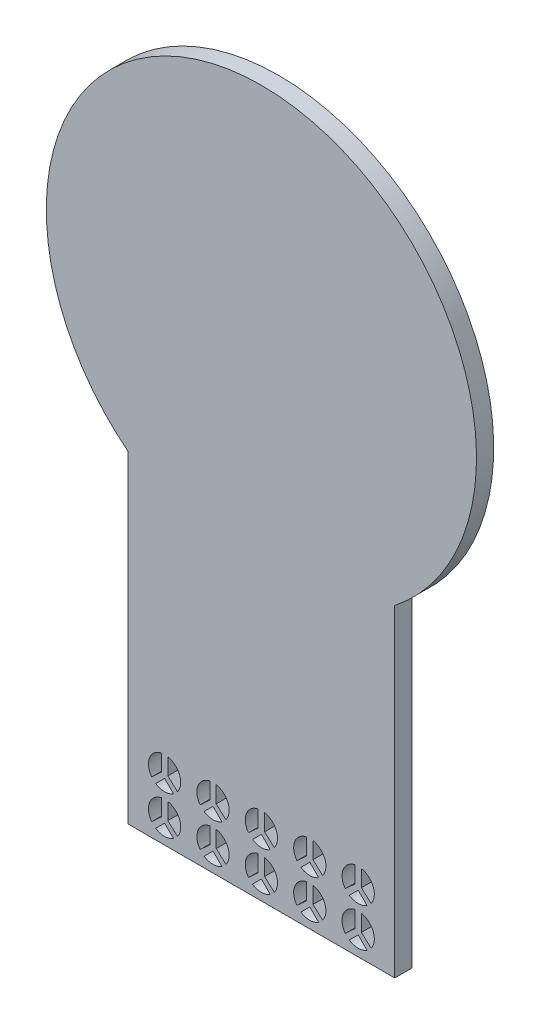
from build123d import *

# Parameters (mm, degrees)
EXTRUDE_1_DEPTH     = 8
CUT_EXTRUDE_1_DEPTH = 10


with BuildPart() as part:
    # 草图1 → 凸台-拉伸1 (new body)
    with BuildSketch(Plane.XY):
        with BuildLine():
            Line((0, 0), (124, 0))
            Line((124, 0), (124, 150))
            ThreePointArc((124, 150), (62, 328.460180984), (0, 150))
            Line((0, 150), (0, 0))
        make_face()
    extrude(amount=EXTRUDE_1_DEPTH)

    # 草图2 → 切除-拉伸1 (cut)
    with BuildSketch(Plane.XY.offset(8)):
        with BuildLine():
            Line((38.000879916, 18.335012989), (38.000879916, 10.614550667))
            Line((38.000879916, 10.614550667), (33.500377126, 6.485861413))
            ThreePointArc((33.500377126, 6.485861413), (32.48869593, 13.649372886), (38.000879916, 18.335012989))
        make_face()
        with BuildLine():
            Line((40.999120084, 18.335012989), (40.999120084, 10.614550667))
            Line((40.999120084, 10.614550667), (45.499622874, 6.485861413))
            ThreePointArc((45.499622874, 6.485861413), (46.51130407, 13.649372886), (40.999120084, 18.335012989))
        make_face()
        with BuildLine():
            Line((43.629589922, 4.725654413), (39.494098953, 8.861145382))
            Line((39.494098953, 8.861145382), (35.363302178, 4.730348608))
            ThreePointArc((35.363302178, 4.730348608), (39.495740959, 3.486365412), (43.629589922, 4.725654413))
        make_face()
        with BuildLine():
            Line((60.500879916, 18.335012989), (60.500879916, 10.614550667))
            Line((60.500879916, 10.614550667), (56.000377126, 6.485861413))
            ThreePointArc((56.000377126, 6.485861413), (54.98869593, 13.649372886), (60.500879916, 18.335012989))
        make_face()
        with BuildLine():
            Line((63.499120084, 18.335012989), (63.499120084, 10.614550667))
            Line((63.499120084, 10.614550667), (67.999622874, 6.485861413))
            ThreePointArc((67.999622874, 6.485861413), (69.01130407, 13.649372886), (63.499120084, 18.335012989))
        make_face()
        with BuildLine():
            Line((66.129589922, 4.725654413), (61.994098953, 8.861145382))
            Line((61.994098953, 8.861145382), (57.863302178, 4.730348608))
            ThreePointArc((57.863302178, 4.730348608), (61.995740959, 3.486365412), (66.129589922, 4.725654413))
        make_face()
        with BuildLine():
            Line((83.000879916, 18.335012989), (83.000879916, 10.614550667))
            Line((83.000879916, 10.614550667), (78.500377126, 6.485861413))
            ThreePointArc((78.500377126, 6.485861413), (77.48869593, 13.649372886), (83.000879916, 18.335012989))
        make_face()
        with BuildLine():
            Line((85.999120084, 18.335012989), (85.999120084, 10.614550667))
            Line((85.999120084, 10.614550667), (90.499622874, 6.485861413))
            ThreePointArc((90.499622874, 6.485861413), (91.51130407, 13.649372886), (85.999120084, 18.335012989))
        make_face()
        with BuildLine():
            Line((88.629589922, 4.725654413), (84.494098953, 8.861145382))
            Line((84.494098953, 8.861145382), (80.363302178, 4.730348608))
            ThreePointArc((80.363302178, 4.730348608), (84.495740959, 3.486365412), (88.629589922, 4.725654413))
        make_face()
        with BuildLine():
            Line((105.500879916, 18.335012989), (105.500879916, 10.614550667))
            Line((105.500879916, 10.614550667), (101.000377126, 6.485861413))
            ThreePointArc((101.000377126, 6.485861413), (99.98869593, 13.649372886), (105.500879916, 18.335012989))
        make_face()
        with BuildLine():
            Line((108.499120084, 18.335012989), (108.499120084, 10.614550667))
            Line((108.499120084, 10.614550667), (112.999622874, 6.485861413))
            ThreePointArc((112.999622874, 6.485861413), (114.01130407, 13.649372886), (108.499120084, 18.335012989))
        make_face()
        with BuildLine():
            Line((111.129589922, 4.725654413), (106.994098953, 8.861145382))
            Line((106.994098953, 8.861145382), (102.863302178, 4.730348608))
            ThreePointArc((102.863302178, 4.730348608), (106.995740959, 3.486365412), (111.129589922, 4.725654413))
        make_face()
        with BuildLine():
            Line((38.000879916, 36.335012989), (38.000879916, 28.614550667))
            Line((38.000879916, 28.614550667), (33.500377126, 24.485861413))
            ThreePointArc((33.500377126, 24.485861413), (32.48869593, 31.649372886), (38.000879916, 36.335012989))
        make_face()
        with BuildLine():
            Line((40.999120084, 36.335012989), (40.999120084, 28.614550667))
            Line((40.999120084, 28.614550667), (45.499622874, 24.485861413))
            ThreePointArc((45.499622874, 24.485861413), (46.51130407, 31.649372886), (40.999120084, 36.335012989))
        make_face()
        with BuildLine():
            Line((15.500879916, 18.335012989), (15.500879916, 10.614550667))
            Line((15.500879916, 10.614550667), (11.000377126, 6.485861413))
            ThreePointArc((11.000377126, 6.485861413), (9.98869593, 13.649372886), (15.500879916, 18.335012989))
        make_face()
        with BuildLine():
            Line((18.499120084, 18.335012989), (18.499120084, 10.614550667))
            Line((18.499120084, 10.614550667), (22.999622874, 6.485861413))
            ThreePointArc((22.999622874, 6.485861413), (24.01130407, 13.649372886), (18.499120084, 18.335012989))
        make_face()
        with BuildLine():
            Line((21.129589922, 4.725654413), (16.994098953, 8.861145382))
            Line((16.994098953, 8.861145382), (12.863302178, 4.730348608))
            ThreePointArc((12.863302178, 4.730348608), (16.995740959, 3.486365412), (21.129589922, 4.725654413))
        make_face()
        with BuildLine():
            Line((43.629589922, 22.725654413), (39.494098953, 26.861145382))
            Line((39.494098953, 26.861145382), (35.363302178, 22.730348608))
            ThreePointArc((35.363302178, 22.730348608), (39.495740959, 21.486365412), (43.629589922, 22.725654413))
        make_face()
        with BuildLine():
            Line((60.500879916, 36.335012989), (60.500879916, 28.614550667))
            Line((60.500879916, 28.614550667), (56.000377126, 24.485861413))
            ThreePointArc((56.000377126, 24.485861413), (54.98869593, 31.649372886), (60.500879916, 36.335012989))
        make_face()
        with BuildLine():
            Line((63.499120084, 36.335012989), (63.499120084, 28.614550667))
            Line((63.499120084, 28.614550667), (67.999622874, 24.485861413))
            ThreePointArc((67.999622874, 24.485861413), (69.01130407, 31.649372886), (63.499120084, 36.335012989))
        make_face()
        with BuildLine():
            Line((66.129589922, 22.725654413), (61.994098953, 26.861145382))
            Line((61.994098953, 26.861145382), (57.863302178, 22.730348608))
            ThreePointArc((57.863302178, 22.730348608), (61.995740959, 21.486365412), (66.129589922, 22.725654413))
        make_face()
        with BuildLine():
            Line((83.000879916, 36.335012989), (83.000879916, 28.614550667))
            Line((83.000879916, 28.614550667), (78.500377126, 24.485861413))
            ThreePointArc((78.500377126, 24.485861413), (77.48869593, 31.649372886), (83.000879916, 36.335012989))
        make_face()
        with BuildLine():
            Line((85.999120084, 36.335012989), (85.999120084, 28.614550667))
            Line((85.999120084, 28.614550667), (90.499622874, 24.485861413))
            ThreePointArc((90.499622874, 24.485861413), (91.51130407, 31.649372886), (85.999120084, 36.335012989))
        make_face()
        with BuildLine():
            Line((88.629589922, 22.725654413), (84.494098953, 26.861145382))
            Line((84.494098953, 26.861145382), (80.363302178, 22.730348608))
            ThreePointArc((80.363302178, 22.730348608), (84.495740959, 21.486365412), (88.629589922, 22.725654413))
        make_face()
        with BuildLine():
            Line((105.500879916, 36.335012989), (105.500879916, 28.614550667))
            Line((105.500879916, 28.614550667), (101.000377126, 24.485861413))
            ThreePointArc((101.000377126, 24.485861413), (99.98869593, 31.649372886), (105.500879916, 36.335012989))
        make_face()
        with BuildLine():
            Line((108.499120084, 36.335012989), (108.499120084, 28.614550667))
            Line((108.499120084, 28.614550667), (112.999622874, 24.485861413))
            ThreePointArc((112.999622874, 24.485861413), (114.01130407, 31.649372886), (108.499120084, 36.335012989))
        make_face()
        with BuildLine():
            Line((111.129589922, 22.725654413), (106.994098953, 26.861145382))
            Line((106.994098953, 26.861145382), (102.863302178, 22.730348608))
            ThreePointArc((102.863302178, 22.730348608), (106.995740959, 21.486365412), (111.129589922, 22.725654413))
        make_face()
        with BuildLine():
            Line((15.500879916, 36.335012989), (15.500879916, 28.614550667))
            Line((15.500879916, 28.614550667), (11.000377126, 24.485861413))
            ThreePointArc((11.000377126, 24.485861413), (9.98869593, 31.649372886), (15.500879916, 36.335012989))
        make_face()
        with BuildLine():
            Line((18.499120084, 36.335012989), (18.499120084, 28.614550667))
            Line((18.499120084, 28.614550667), (22.999622874, 24.485861413))
            ThreePointArc((22.999622874, 24.485861413), (24.01130407, 31.649372886), (18.499120084, 36.335012989))
        make_face()
        with BuildLine():
            Line((21.129589922, 22.725654413), (16.994098953, 26.861145382))
            Line((16.994098953, 26.861145382), (12.863302178, 22.730348608))
            ThreePointArc((12.863302178, 22.730348608), (16.995740959, 21.486365412), (21.129589922, 22.725654413))
        make_face()
    extrude(amount=-CUT_EXTRUDE_1_DEPTH, mode=Mode.SUBTRACT)


solid = part.part
